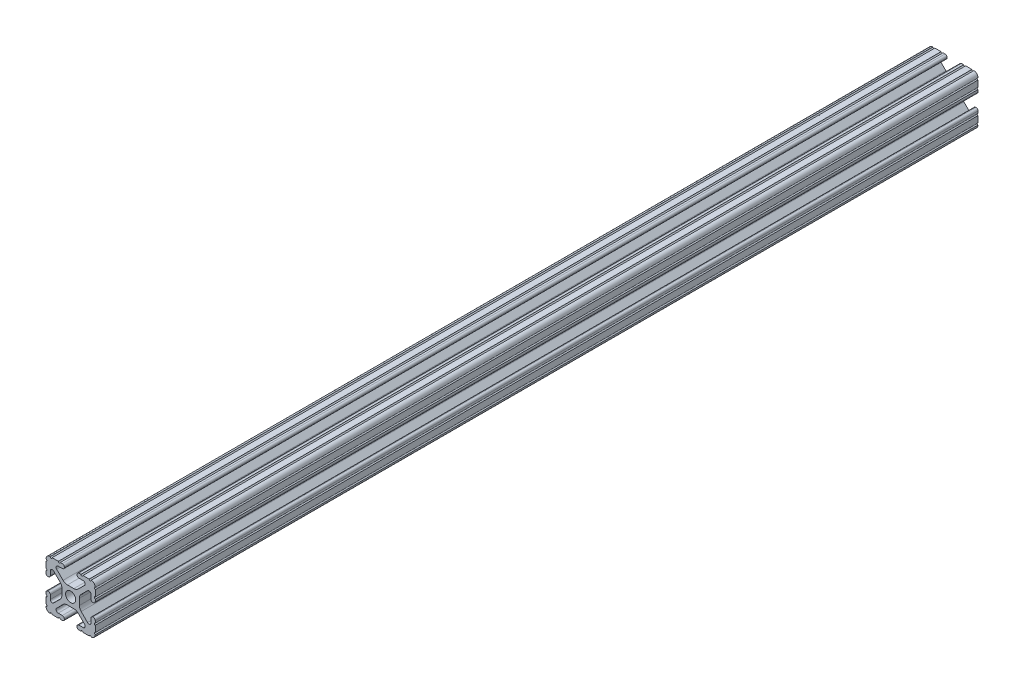
from build123d import *

# Parameters (mm, degrees)
SKETCH1_R           = 2.6035
BOSS_EXTRUDE1_DEPTH = 227.584


with BuildPart() as part:
    # Sketch1 → Boss-Extrude1 (new, symmetric)
    with BuildSketch(Plane.XY):
        with BuildLine():
            Line((-7.179650497, -8.645192506), (-3.952270251, -5.423690499))
            ThreePointArc((-3.952270251, -5.423690499), (-2.922936451, -4.736929036), (-1.709253557, -4.4958))
            Line((-1.709253557, -4.4958), (1.709253557, -4.4958))
            ThreePointArc((1.709253557, -4.4958), (2.922936451, -4.736929036), (3.952270251, -5.423690499))
            Line((3.952270251, -5.423690499), (7.179650497, -8.645192506))
            ThreePointArc((7.179650497, -8.645192506), (7.41473083, -9.822813117), (6.416408329, -10.4902))
            Line((6.416408329, -10.4902), (4.287512407, -10.4902))
            ThreePointArc((4.287512407, -10.4902), (3.54574862, -10.79744862), (3.2385, -11.539212407))
            Line((3.2385, -11.539212407), (3.2385, -11.650987593))
            ThreePointArc((3.2385, -11.650987593), (3.54574862, -12.39275138), (4.287512407, -12.7))
            Line((4.287512407, -12.7), (5.317126718, -12.7))
            ThreePointArc((5.317126718, -12.7), (5.825126718, -12.192), (6.333126718, -12.7))
            Line((6.333126718, -12.7), (9.550443118, -12.7))
            ThreePointArc((9.550443118, -12.7), (10.058366869, -12.192000006), (10.566443095, -12.699847501))
            ThreePointArc((10.566443095, -12.699847501), (12.082537762, -12.08250727), (12.699846982, -10.566399977))
            ThreePointArc((12.699846982, -10.566399977), (12.192000006, -10.058323491), (12.7, -9.5504))
            Line((12.7, -9.5504), (12.7, -6.3330836))
            ThreePointArc((12.7, -6.3330836), (12.192, -5.8250836), (12.7, -5.3170836))
            Line((12.7, -5.3170836), (12.7, -4.287469289))
            ThreePointArc((12.7, -4.287469289), (12.39275138, -3.545705502), (11.650987593, -3.238456882))
            Line((11.650987593, -3.238456882), (11.539212407, -3.238456882))
            ThreePointArc((11.539212407, -3.238456882), (10.79744862, -3.545705502), (10.4902, -4.287469289))
            Line((10.4902, -4.287469289), (10.4902, -6.402089023))
            ThreePointArc((10.4902, -6.402089023), (9.856505071, -7.351067942), (8.737131347, -7.129408934))
            Line((8.737131347, -7.129408934), (5.441005833, -3.840816462))
            ThreePointArc((5.441005833, -3.840816462), (4.750877967, -2.809883091), (4.5085, -1.593185507))
            Line((4.5085, -1.593185507), (4.5085, 1.593185507))
            ThreePointArc((4.5085, 1.593185507), (4.750877967, 2.809883091), (5.441005833, 3.840816462))
            Line((5.441005833, 3.840816462), (8.737131347, 7.129408934))
            ThreePointArc((8.737131347, 7.129408934), (9.856505071, 7.351067942), (10.4902, 6.402089023))
            Line((10.4902, 6.402089023), (10.4902, 4.287469289))
            ThreePointArc((10.4902, 4.287469289), (10.79744862, 3.545705502), (11.539212407, 3.238456882))
            Line((11.539212407, 3.238456882), (11.650987593, 3.238456882))
            ThreePointArc((11.650987593, 3.238456882), (12.39275138, 3.545705502), (12.7, 4.287469289))
            Line((12.7, 4.287469289), (12.7, 5.3170836))
            ThreePointArc((12.7, 5.3170836), (12.192, 5.8250836), (12.7, 6.3330836))
            Line((12.7, 6.3330836), (12.7, 9.5504))
            ThreePointArc((12.7, 9.5504), (12.192000006, 10.058323491), (12.699846982, 10.566399977))
            ThreePointArc((12.699846982, 10.566399977), (12.082537762, 12.08250727), (10.566443095, 12.699847501))
            ThreePointArc((10.566443095, 12.699847501), (10.058366869, 12.192000006), (9.550443118, 12.7))
            Line((9.550443118, 12.7), (6.333126718, 12.7))
            ThreePointArc((6.333126718, 12.7), (5.825126718, 12.192), (5.317126718, 12.7))
            Line((5.317126718, 12.7), (4.287512407, 12.7))
            ThreePointArc((4.287512407, 12.7), (3.54574862, 12.39275138), (3.2385, 11.650987593))
            Line((3.2385, 11.650987593), (3.2385, 11.539212407))
            ThreePointArc((3.2385, 11.539212407), (3.54574862, 10.79744862), (4.287512407, 10.4902))
            Line((4.287512407, 10.4902), (6.476788598, 10.4902))
            ThreePointArc((6.476788598, 10.4902), (7.432222385, 9.85140422), (7.207036008, 8.724370562))
            Line((7.207036008, 8.724370562), (3.898272566, 5.423169045))
            ThreePointArc((3.898272566, 5.423169045), (2.869120213, 4.736787962), (1.655778399, 4.4958))
            Line((1.655778399, 4.4958), (-1.655778399, 4.4958))
            ThreePointArc((-1.655778399, 4.4958), (-2.869120213, 4.736787962), (-3.898272566, 5.423169045))
            Line((-3.898272566, 5.423169045), (-7.207036008, 8.724370562))
            ThreePointArc((-7.207036008, 8.724370562), (-7.432222385, 9.85140422), (-6.476788598, 10.4902))
            Line((-6.476788598, 10.4902), (-4.287512407, 10.4902))
            ThreePointArc((-4.287512407, 10.4902), (-3.54574862, 10.79744862), (-3.2385, 11.539212407))
            Line((-3.2385, 11.539212407), (-3.2385, 11.650987593))
            ThreePointArc((-3.2385, 11.650987593), (-3.54574862, 12.39275138), (-4.287512407, 12.7))
            Line((-4.287512407, 12.7), (-5.317126718, 12.7))
            ThreePointArc((-5.317126718, 12.7), (-5.825126718, 12.192), (-6.333126718, 12.7))
            Line((-6.333126718, 12.7), (-9.550443118, 12.7))
            ThreePointArc((-9.550443118, 12.7), (-10.058366869, 12.192000006), (-10.566443095, 12.699847501))
            ThreePointArc((-10.566443095, 12.699847501), (-12.082537762, 12.08250727), (-12.699846982, 10.566399977))
            ThreePointArc((-12.699846982, 10.566399977), (-12.192000006, 10.058323491), (-12.7, 9.5504))
            Line((-12.7, 9.5504), (-12.7, 6.3330836))
            ThreePointArc((-12.7, 6.3330836), (-12.192, 5.8250836), (-12.7, 5.3170836))
            Line((-12.7, 5.3170836), (-12.7, 4.287469289))
            ThreePointArc((-12.7, 4.287469289), (-12.39275138, 3.545705502), (-11.650987593, 3.238456882))
            Line((-11.650987593, 3.238456882), (-11.539212407, 3.238456882))
            ThreePointArc((-11.539212407, 3.238456882), (-10.79744862, 3.545705502), (-10.4902, 4.287469289))
            Line((-10.4902, 4.287469289), (-10.4902, 6.402089023))
            ThreePointArc((-10.4902, 6.402089023), (-9.856505071, 7.351067942), (-8.737131347, 7.129408934))
            Line((-8.737131347, 7.129408934), (-5.441005833, 3.840816462))
            ThreePointArc((-5.441005833, 3.840816462), (-4.750877967, 2.809883091), (-4.5085, 1.593185507))
            Line((-4.5085, 1.593185507), (-4.5085, -1.593185507))
            ThreePointArc((-4.5085, -1.593185507), (-4.750877967, -2.809883091), (-5.441005833, -3.840816462))
            Line((-5.441005833, -3.840816462), (-8.737131347, -7.129408934))
            ThreePointArc((-8.737131347, -7.129408934), (-9.856505071, -7.351067942), (-10.4902, -6.402089023))
            Line((-10.4902, -6.402089023), (-10.4902, -4.287469289))
            ThreePointArc((-10.4902, -4.287469289), (-10.79744862, -3.545705502), (-11.539212407, -3.238456882))
            Line((-11.539212407, -3.238456882), (-11.650987593, -3.238456882))
            ThreePointArc((-11.650987593, -3.238456882), (-12.39275138, -3.545705502), (-12.7, -4.287469289))
            Line((-12.7, -4.287469289), (-12.7, -5.3170836))
            ThreePointArc((-12.7, -5.3170836), (-12.192, -5.8250836), (-12.7, -6.3330836))
            Line((-12.7, -6.3330836), (-12.7, -9.5504))
            ThreePointArc((-12.7, -9.5504), (-12.192000006, -10.058323491), (-12.699846982, -10.566399977))
            ThreePointArc((-12.699846982, -10.566399977), (-12.082537762, -12.08250727), (-10.566443095, -12.699847501))
            ThreePointArc((-10.566443095, -12.699847501), (-10.058366869, -12.192000006), (-9.550443118, -12.7))
            Line((-9.550443118, -12.7), (-6.333126718, -12.7))
            ThreePointArc((-6.333126718, -12.7), (-5.825126718, -12.192), (-5.317126718, -12.7))
            Line((-5.317126718, -12.7), (-4.287512407, -12.7))
            ThreePointArc((-4.287512407, -12.7), (-3.54574862, -12.39275138), (-3.2385, -11.650987593))
            Line((-3.2385, -11.650987593), (-3.2385, -11.539212407))
            ThreePointArc((-3.2385, -11.539212407), (-3.54574862, -10.79744862), (-4.287512407, -10.4902))
            Line((-4.287512407, -10.4902), (-6.416408329, -10.4902))
            ThreePointArc((-6.416408329, -10.4902), (-7.41473083, -9.822813117), (-7.179650497, -8.645192506))
        make_face()
        Circle(SKETCH1_R, mode=Mode.SUBTRACT)
    extrude(amount=BOSS_EXTRUDE1_DEPTH, both=True)


solid = part.part
